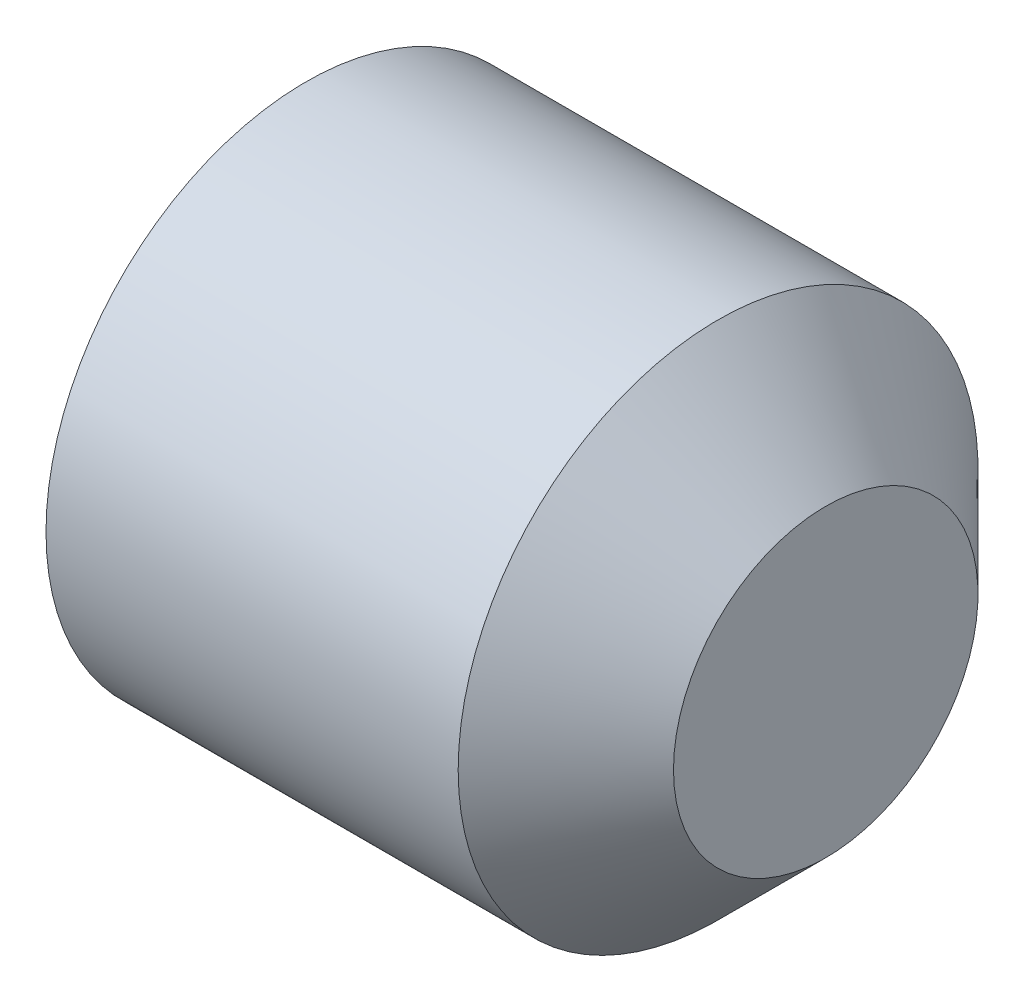
from build123d import *

# Parameters (mm, degrees)
CUT_EXTRUDE1_DEPTH = 1.5


with BuildPart() as part:
    # Sketch1 → Revolve1 (revolve)
    with BuildSketch(Plane.XY, mode=Mode.PRIVATE) as revolve1_sk:
        Polygon((4, 1.171572875), (4, 0), (0, 0), (0, 2), (3.171572875, 2), align=None)
    revolve(revolve1_sk.sketch.rotate(Axis((0, 0, 0), (1, 0, 0)), 90), axis=Axis((0, 0, 0), (1, 0, 0)))

    # Sketch2 → Cut-Extrude1 (cut)
    with BuildSketch(Plane.ZY):
        Polygon((-0.577350269, 1), (-1.154700538, 0), (-0.577350269, -1), (0.577350269, -1), (1.154700538, 0), (0.577350269, 1), align=None)
    extrude(amount=-CUT_EXTRUDE1_DEPTH, mode=Mode.SUBTRACT)


solid = part.part
